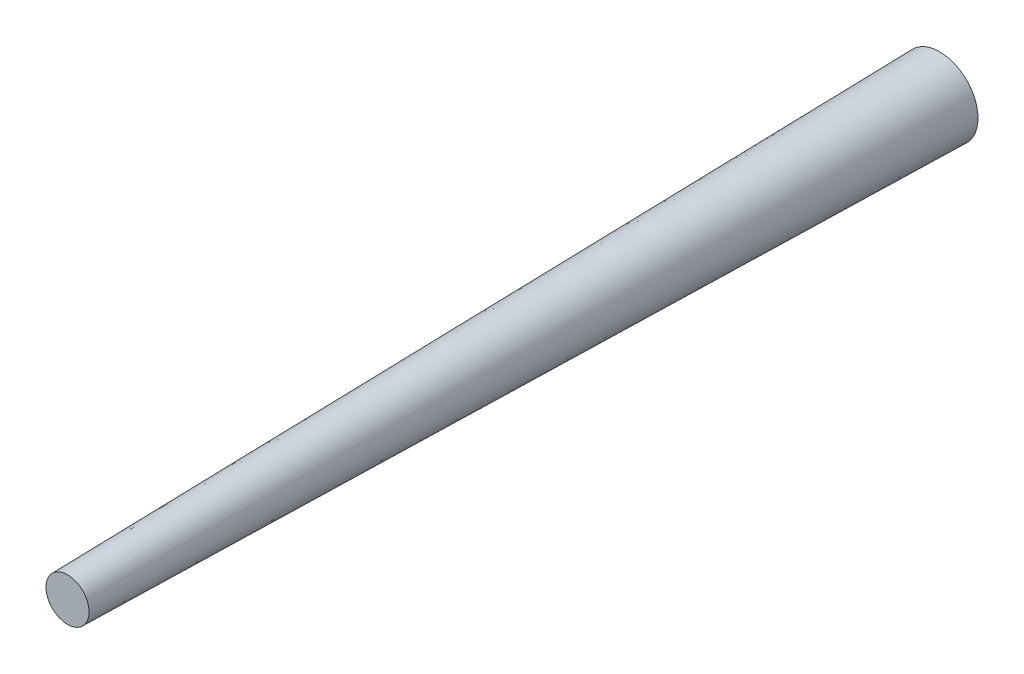
from build123d import *


with BuildPart() as part:
    # Sketch1 → Revolve1 (revolve)
    with BuildSketch(Plane(origin=(0, 0, 0), x_dir=(1, 0, 0), z_dir=(0, 1, 0))):
        Polygon((27, -409.69227612), (0, -409.69227612), (0, -1024.69227612), (15.191396742, -1024.69227612), align=None)
    revolve(axis=Axis((0, 0, 409.69227612), (0, 0, 1)))


solid = part.part
